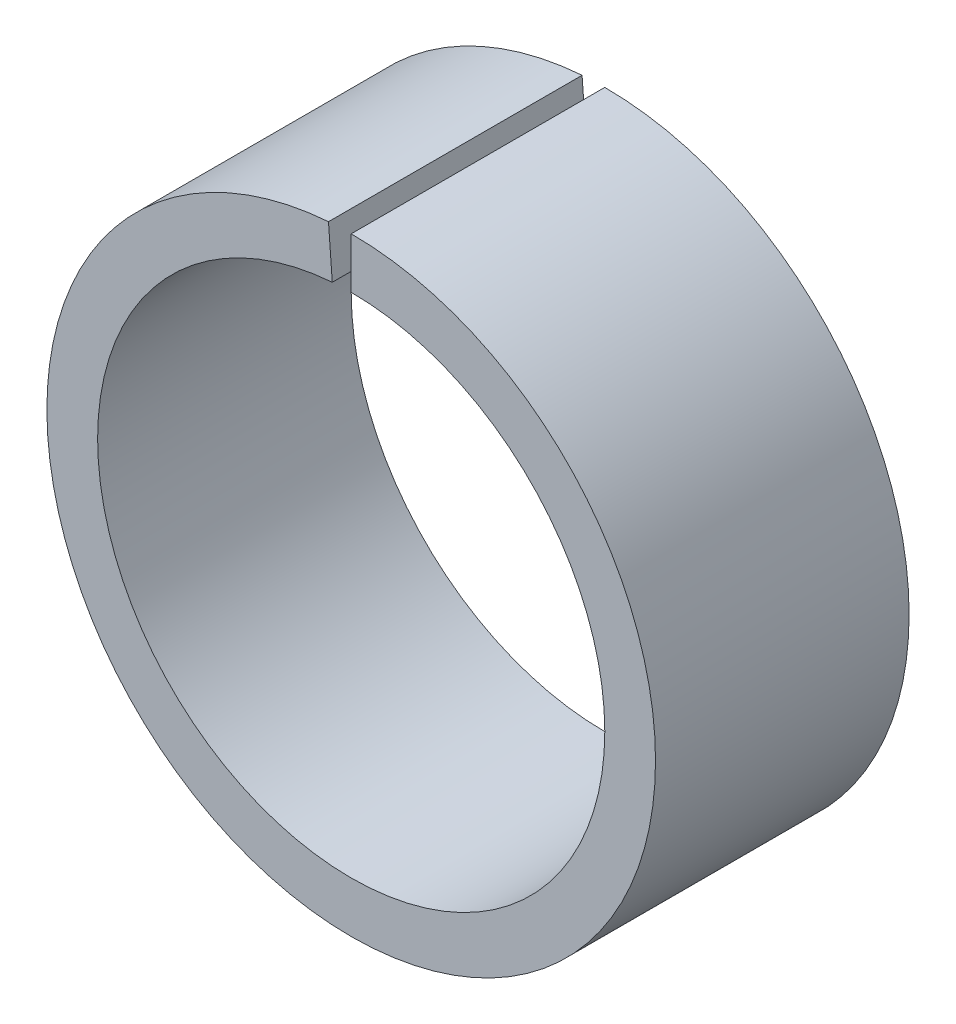
from build123d import *

# Parameters (mm, degrees)
SKETCH_1_R          = 6
SKETCH_1_R_2        = 5
EXTRUDE_1_DEPTH     = 5
CUT_EXTRUDE_1_DEPTH = 10


with BuildPart() as part:
    # 草图1 → 凸台-拉伸1 (new body)
    with BuildSketch(Plane.XY):
        Circle(SKETCH_1_R)
        Circle(SKETCH_1_R_2, mode=Mode.SUBTRACT)
    extrude(amount=EXTRUDE_1_DEPTH)

    # 草图2 → 切除-拉伸1 (cut)
    with BuildSketch(Plane.XY.offset(5)):
        Polygon((0, 0), (0, 10.777927296), (-0.806504289, 10.777927296), align=None)
    extrude(amount=-CUT_EXTRUDE_1_DEPTH, mode=Mode.SUBTRACT)


solid = part.part
